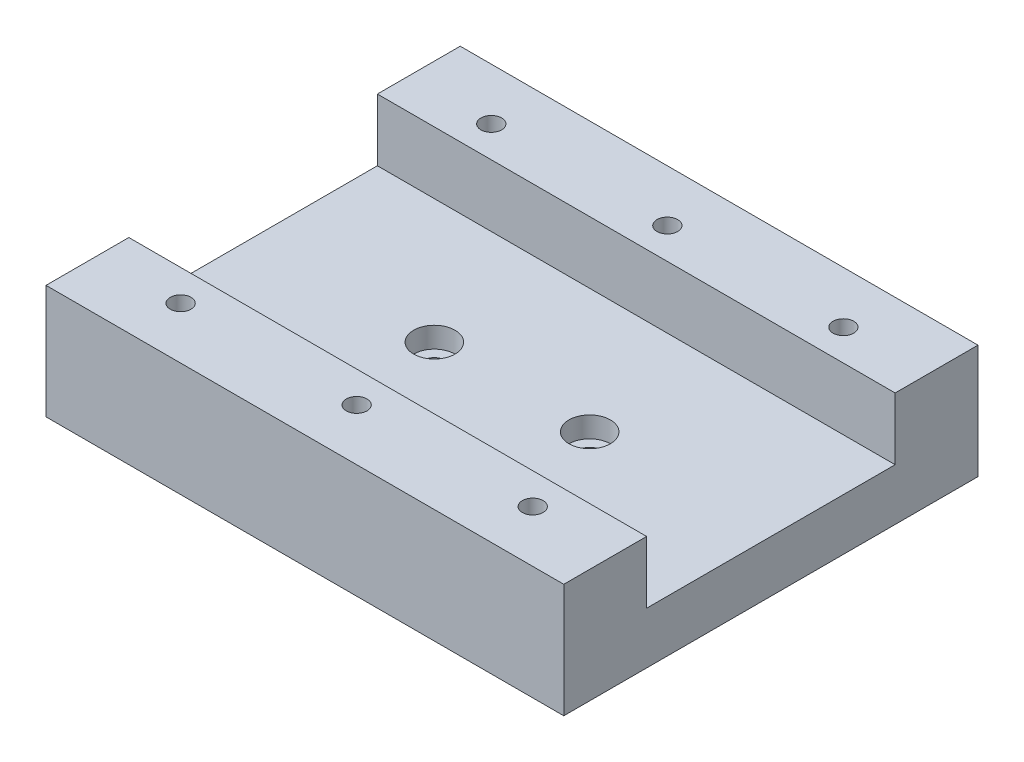
from build123d import *

# Parameters (mm, degrees)
SKETCH1_W               = 50
SKETCH1_H               = 40
BOSS_EXTRUDE1_DEPTH     = 5
SKETCH2_R               = 1
CUT_EXTRUDE1_DEPTH      = 33.403703492
SKETCH3_R               = 2
CUT_EXTRUDE2_DEPTH      = 2
SKETCH5_W               = 50
SKETCH5_H               = 8
BOSS_EXTRUDE2_DEPTH     = 6
CUT_EXTRUDE3_DEPTH      = 33.57299495
CUT_EXTRUDE3_DEPTH_BACK = 33.57299495
SKETCH4_R               = 1


with BuildPart() as part:
    # Sketch1 → Boss-Extrude1 (new body)
    with BuildSketch(Plane(origin=(0, 0, 0), x_dir=(1, 0, 0), z_dir=(0, 1, 0))):
        Rectangle(SKETCH1_W, SKETCH1_H)
    extrude(amount=BOSS_EXTRUDE1_DEPTH)

    # Sketch2 → Cut-Extrude1 (cut, through all)
    with BuildSketch(Plane(origin=(0, 5, 0), x_dir=(1, 0, 0), z_dir=(0, 1, 0))):
        with Locations(Location((-7.5, 0, 0), (0, 0, 270))):
            Circle(SKETCH2_R)
        with Locations(Location((7.5, 0, 0), (0, 0, 270))):
            Circle(SKETCH2_R)
    extrude(amount=-CUT_EXTRUDE1_DEPTH, mode=Mode.SUBTRACT)

    # Sketch3 → Cut-Extrude2 (cut)
    with BuildSketch(Plane(origin=(0, 5, 0), x_dir=(1, 0, 0), z_dir=(0, 1, 0))):
        with Locations(Location((-7.5, 0, 0), (0, 0, 270))):
            Circle(SKETCH3_R)
        with Locations(Location((7.5, 0, 0), (0, 0, 270))):
            Circle(SKETCH3_R)
    extrude(amount=-CUT_EXTRUDE2_DEPTH, mode=Mode.SUBTRACT)

    # Sketch5 → Boss-Extrude2 (add)
    with BuildSketch(Plane(origin=(0, 5, 0), x_dir=(1, 0, 0), z_dir=(0, 1, 0))):
        with Locations((0, 16)):
            Rectangle(SKETCH5_W, SKETCH5_H)
        with Locations((0, -16)):
            Rectangle(SKETCH5_W, SKETCH5_H)
    extrude(amount=BOSS_EXTRUDE2_DEPTH)

    # Sketch4 → Cut-Extrude3 (cut, two sides: drawn at the far end of the back side and taken through both)
    with BuildSketch(Plane(origin=(0, 5, 0), x_dir=(1, 0, 0), z_dir=(0, 1, 0)).offset(-CUT_EXTRUDE3_DEPTH_BACK)):
        with Locations(Location((-17, 15, 0), (0, 0, 270))):
            Circle(SKETCH4_R)
        with Locations(Location((0, 15, 0), (0, 0, 270))):
            Circle(SKETCH4_R)
        with Locations(Location((17, 15, 0), (0, 0, 270))):
            Circle(SKETCH4_R)
        with Locations(Location((-17, -15, 0), (0, 0, 270))):
            Circle(SKETCH4_R)
        with Locations(Location((0, -15, 0), (0, 0, 270))):
            Circle(SKETCH4_R)
        with Locations(Location((17, -15, 0), (0, 0, 270))):
            Circle(SKETCH4_R)
    extrude(amount=CUT_EXTRUDE3_DEPTH + CUT_EXTRUDE3_DEPTH_BACK, mode=Mode.SUBTRACT)


solid = part.part
